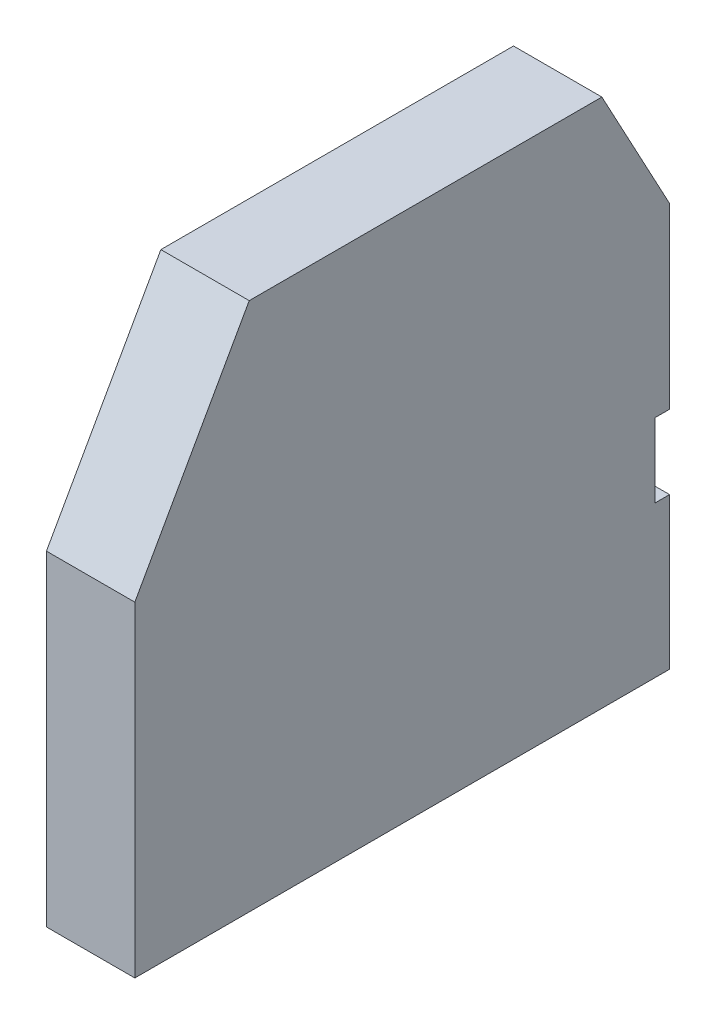
from build123d import *

# Parameters (mm, degrees)
SKETCH_1_W          = 2
SKETCH_1_H          = 12.1
EXTRUDE_1_DEPTH     = 13.2
SKETCH_2_W          = 0.330714911
SKETCH_2_H          = 1.671791026
CUT_EXTRUDE_1_DEPTH = 13.2


with BuildPart() as part:
    # 草图1 → 凸台-拉伸1 (new body)
    with BuildSketch(Plane(origin=(0, 0, 0), x_dir=(1, 0, 0), z_dir=(0, 1, 0))):
        Rectangle(SKETCH_1_W, SKETCH_1_H)
    extrude(amount=EXTRUDE_1_DEPTH)

    # 草图2 → 切除-拉伸1 (cut)
    with BuildSketch(Plane.ZY.offset(1)):
        with Locations((-5.884642545, 4.259492563)):
            Rectangle(SKETCH_2_W, SKETCH_2_H)
        Polygon((-4.518682009, 11.98), (-6.05, 9.129739953), (-6.05, 13.2), (6.05, 13.2), (6.05, 7.365579196), (3.461422835, 11.98), align=None)
    extrude(amount=-CUT_EXTRUDE_1_DEPTH, mode=Mode.SUBTRACT)


solid = part.part
